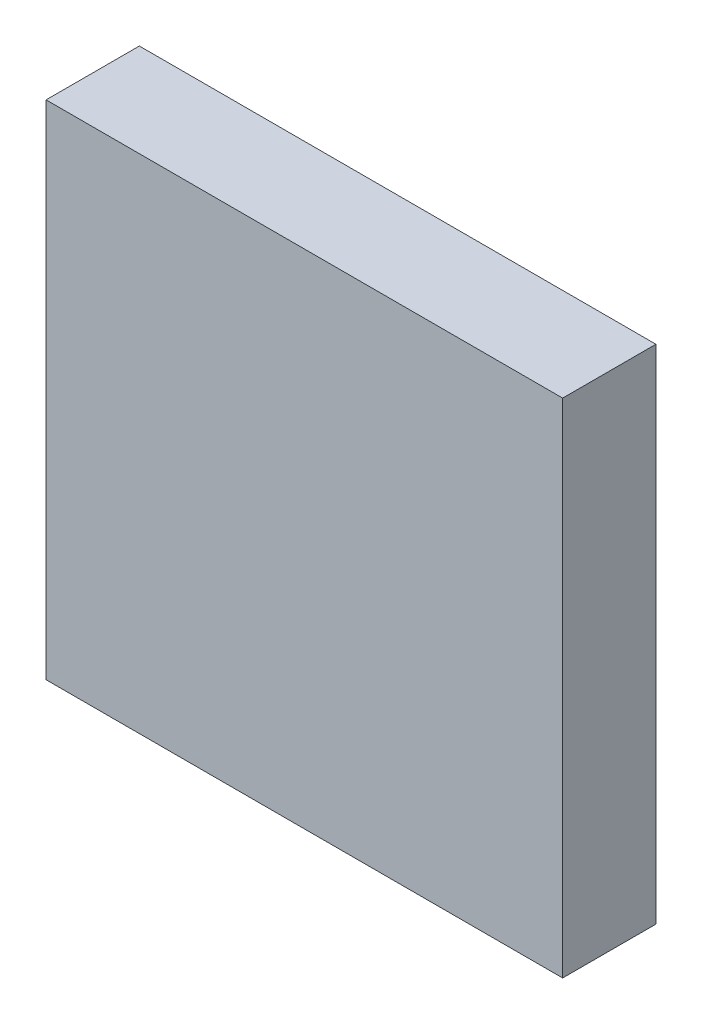
from build123d import *

# Parameters (mm, degrees)
SKETCH1_W           = 360
SKETCH1_H           = 65
BOSS_EXTRUDE1_DEPTH = 350


with BuildPart() as part:
    # Sketch1 → Boss-Extrude1 (new body)
    with BuildSketch(Plane(origin=(0, 0, 0), x_dir=(1, 0, 0), z_dir=(0, 1, 0))):
        with Locations((103.5, -25.25)):
            Rectangle(SKETCH1_W, SKETCH1_H)
    extrude(amount=BOSS_EXTRUDE1_DEPTH)


solid = part.part
